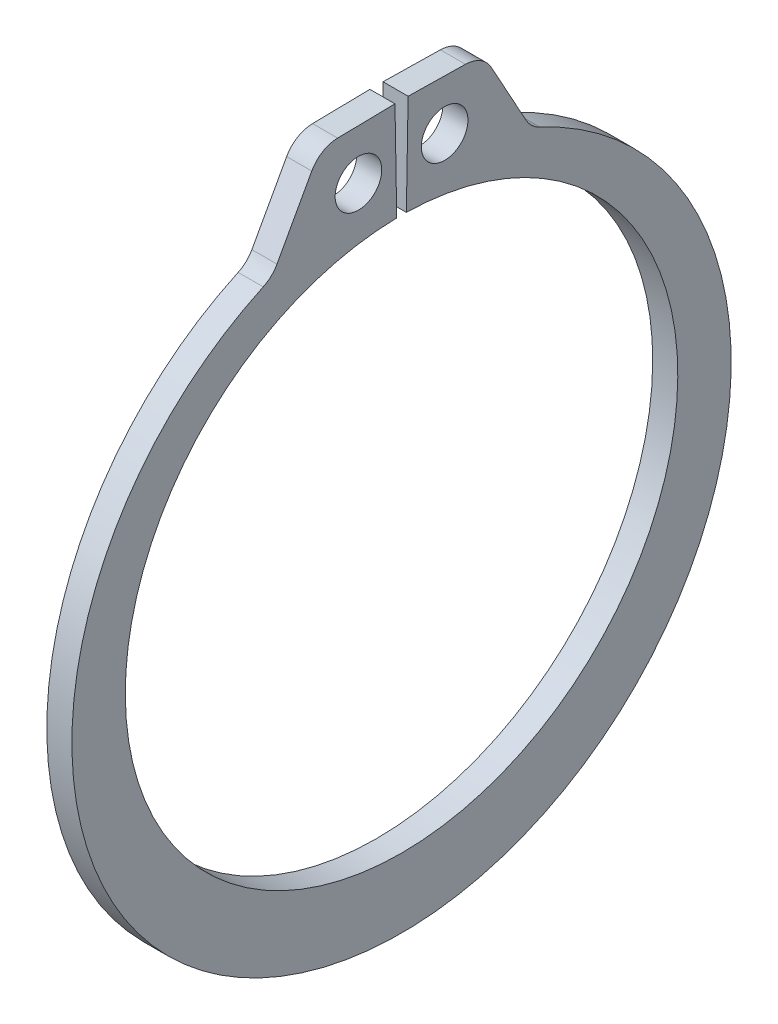
from build123d import *

# Parameters (mm, degrees)
SKETCH1_R           = 0.9906
BOSS_EXTRUDE1_DEPTH = 1.0668


with BuildPart() as part:
    # Sketch1 → Boss-Extrude1 (new body)
    with BuildSketch(Plane(origin=(-0.5334, 0, 0), x_dir=(0, -1, 0), z_dir=(-1, 0, 0))):
        with BuildLine():
            Line((-15.94431198, 2.716898433), (-15.986864752, 0.279051762))
            Line((-15.986864752, 0.279051762), (-11.745710799, 0.205022145))
            ThreePointArc((-11.745710799, 0.205022145), (11.7475, 0), (-11.745710799, -0.205022145))
            Line((-11.745710799, -0.205022145), (-15.986864752, -0.279051762))
            Line((-15.986864752, -0.279051762), (-15.94431198, -2.716898433))
            ThreePointArc((-15.94431198, -2.716898433), (-15.76030474, -3.356798239), (-15.280307949, -3.818245425))
            Line((-15.280307949, -3.818245425), (-12.59324173, -5.297201549))
            ThreePointArc((-12.59324173, -5.297201549), (-12.273517846, -5.546261035), (-12.04745792, -5.882640135))
            ThreePointArc((-12.04745792, -5.882640135), (14.6939, 0), (-12.04745792, 5.882640135))
            ThreePointArc((-12.04745792, 5.882640135), (-12.273517846, 5.546261035), (-12.59324173, 5.297201549))
            Line((-12.59324173, 5.297201549), (-15.280307949, 3.818245425))
            ThreePointArc((-15.280307949, 3.818245425), (-15.76030474, 3.356798239), (-15.94431198, 2.716898433))
        make_face()
        with Locations(Location((-13.838526669, -1.832469686, 0), (0, 0, 270))):
            Circle(SKETCH1_R, mode=Mode.SUBTRACT)
        with Locations(Location((-13.838526669, 1.832469686, 0), (0, 0, 270))):
            Circle(SKETCH1_R, mode=Mode.SUBTRACT)
    extrude(amount=-BOSS_EXTRUDE1_DEPTH)


solid = part.part
